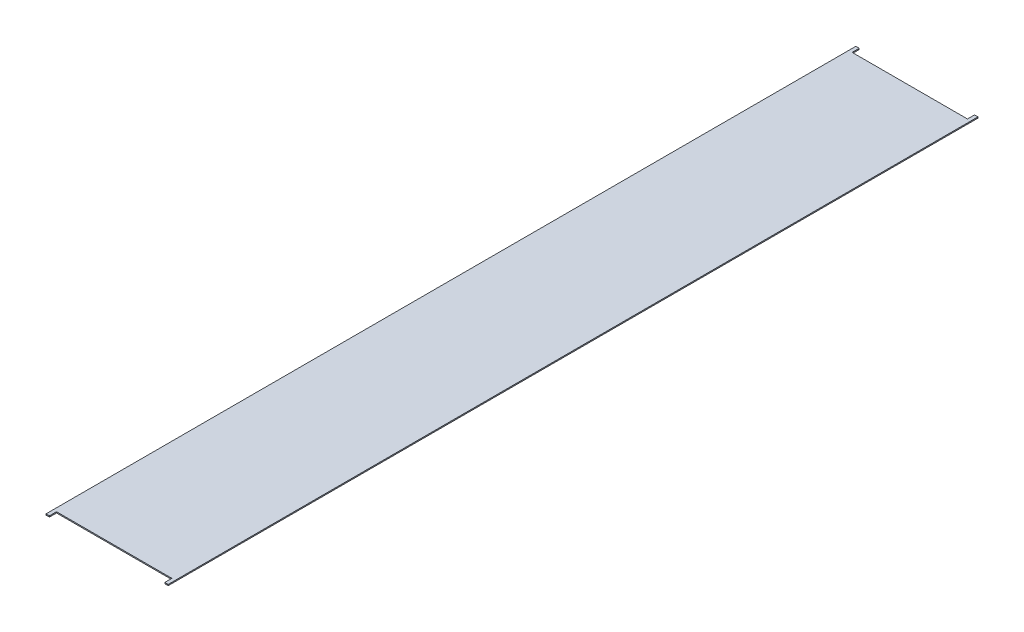
from build123d import *

# Parameters (mm, degrees)
ESQUISSE1_W             = 430
ESQUISSE1_H             = 4
BOSS_EXTRU_1_DEPTH      = 2850
ESQUISSE10_W            = 406
ESQUISSE10_H            = 25
ENL_V_MAT_EXTRU_1_DEPTH = 2880.342980612


with BuildPart() as part:
    # Esquisse1 → Boss.-Extru.1 (new body)
    with BuildSketch(Plane.XY):
        with Locations((195, 37)):
            Rectangle(ESQUISSE1_W, ESQUISSE1_H)
    extrude(amount=BOSS_EXTRU_1_DEPTH)

    # Esquisse10 → Enlèv. mat.-Extru.1 (cut, through all)
    with BuildSketch(Plane.XZ.offset(-35)):
        with Locations((195, 12.5)):
            Rectangle(ESQUISSE10_W, ESQUISSE10_H)
        with Locations((195, 2837.5)):
            Rectangle(ESQUISSE10_W, ESQUISSE10_H)
    extrude(amount=-ENL_V_MAT_EXTRU_1_DEPTH, mode=Mode.SUBTRACT)


solid = part.part
